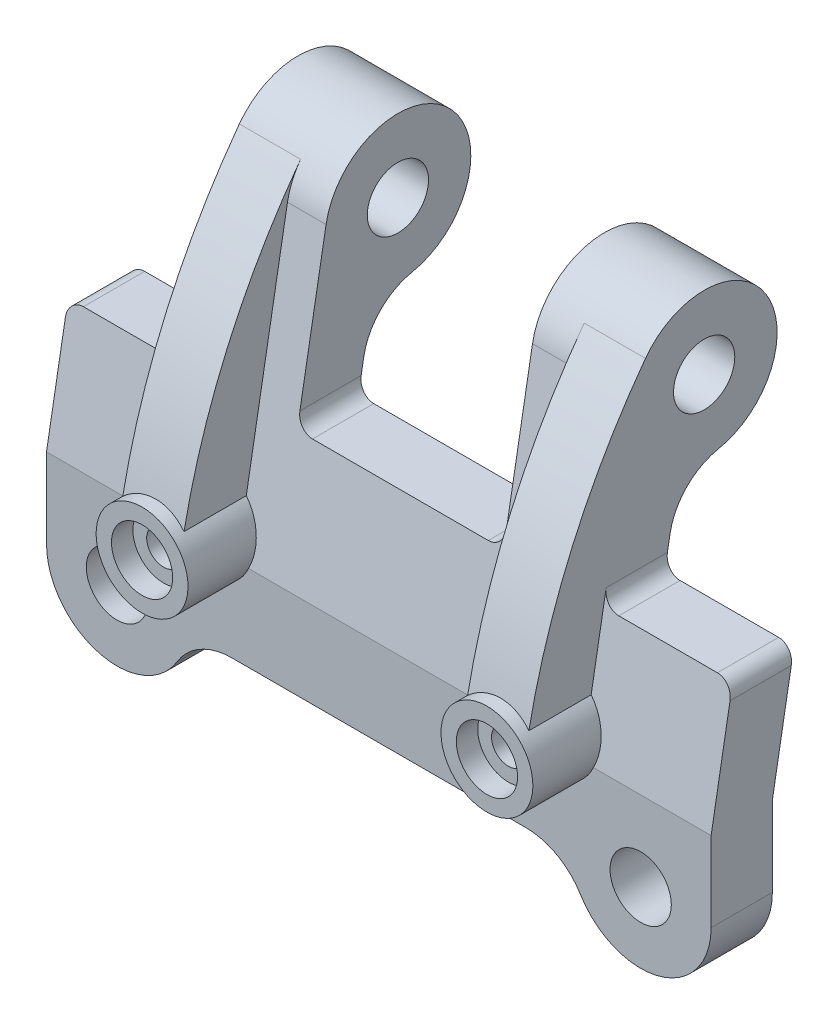
from build123d import *
from build123d.topology import SkipClean

# Parameters (mm, degrees)
BOSS_EXTRUDE1_DEPTH                                 = 13.7795
SKETCH3_R                                           = 1.27
CUT_EXTRUDE1_DEPTH                                  = 28.24278526
BOSS_EXTRUDE3_REACH                                 = 29.243
SKETCH4_R                                           = 3.024456955
BOSS_EXTRUDE3_DIRECTION_2_REACH                     = 29.243
CUT_EXTRUDE2_START                                  = -27.686
SKETCH5_R                                           = 1.27
CUT_EXTRUDE2_DEPTH                                  = 27.686
SKETCH6_W                                           = 5.3594
SKETCH6_H                                           = 6.04891391
SKETCH6_W_2                                         = 8.5598
CUT_EXTRUDE3_DEPTH                                  = 27.163772894
FILLET1_R                                           = 2.54
BOSS_EXTRUDE5_DEPTH                                 = 2.54
SKETCH8_R                                           = 1.905
BOSS_EXTRUDE6_DEPTH                                 = 5.207
CBORE_FOR_00_BINDING_HEAD_MACHINE_SCREW_D           = 1.397
CBORE_FOR_00_BINDING_HEAD_MACHINE_SCREW_DEPTH       = 3.81
CBORE_FOR_00_BINDING_HEAD_MACHINE_SCREW_CBORE_D     = 2.54
CBORE_FOR_00_BINDING_HEAD_MACHINE_SCREW_CBORE_DEPTH = 0.889
CBORE_FOR_00_BINDING_HEAD_MACHINE_SCREW_TIP         = 0.419701142
FILLET3_R                                           = 0.635


with BuildPart() as part:
    # Sketch2 → Boss-Extrude1 (new, symmetric)
    with BuildSketch(Plane(origin=(0, 0, 0), x_dir=(0, 0, -1), z_dir=(1, 0, 0))):
        Polygon((0.358296425, 8.382), (0, 6.35), (0, 0), (2.54, 0), (2.54, 6.35), (2.898296425, 8.382), (5.451158451, 22.86), (2.911158451, 22.86), align=None)
    extrude(amount=BOSS_EXTRUDE1_DEPTH, both=True)

    # Sketch3 → Cut-Extrude1 (cut, through all)
    with BuildSketch(Plane.XY):
        with Locations((-10.8585, 3.039071392)):
            Circle(SKETCH3_R)
        with Locations((10.8585, 3.039071392)):
            Circle(SKETCH3_R)
        with BuildLine():
            Line((-6.093079, 2.794), (6.093079, 2.794))
            ThreePointArc((6.093079, 2.794), (7.395567274, 2.453324554), (8.364453302, 1.518554352))
            ThreePointArc((8.364453302, 1.518554352), (11.648161508, 0.226834613), (13.7795, 3.039071392))
            Line((13.7795, 3.039071392), (14.4145, 3.039071392))
            Line((14.4145, 3.039071392), (14.4145, -0.635))
            Line((14.4145, -0.635), (-14.4145, -0.635))
            Line((-14.4145, -0.635), (-14.4145, 3.039071392))
            Line((-14.4145, 3.039071392), (-13.7795, 3.039071392))
            ThreePointArc((-13.7795, 3.039071392), (-11.648161508, 0.226834613), (-8.364453302, 1.518554352))
            ThreePointArc((-8.364453302, 1.518554352), (-7.395567274, 2.453324554), (-6.093079, 2.794))
        make_face()
        Polygon((-14.4145, 11.43), (-8.4201, 11.43), (-8.4201, 22.86), (-4.2799, 22.86), (-4.2799, 11.43), (4.2799, 11.43), (4.2799, 22.86), (8.4201, 22.86), (8.4201, 11.43), (14.4145, 11.43), (14.4145, 23.495), (-14.4145, 23.495), align=None)
    extrude(amount=-CUT_EXTRUDE1_DEPTH, mode=Mode.SUBTRACT)

    # Boss-Extrude3: up to this face of the body (flat: up to its plane)
    boss_extrude3_end = Plane(part.part.faces().sort_by_distance((13.7795, 7.234535696, -1.541147855))[0])
    # Sketch4 → Boss-Extrude3 (add, up to the picked face)
    with BuildSketch(Plane(origin=(0, 0, 0), x_dir=(0, 0, -1), z_dir=(1, 0, 0)), mode=Mode.PRIVATE) as boss_extrude3_sk1:
        with Locations(Location((5.070856, 17.6911, 0), (0, 0, 180))):
            Circle(SKETCH4_R)
    boss_extrude3_tool1 = split(extrude(boss_extrude3_sk1.sketch, amount=BOSS_EXTRUDE3_REACH, mode=Mode.PRIVATE), bisect_by=boss_extrude3_end, keep=Keep.BOTH, mode=Mode.PRIVATE)
    add(boss_extrude3_tool1.solids().sort_by(Axis((0, 17.6911, -5.070856), (1, 0, 0)))[0])

    # Boss-Extrude3 direction 2: up to this face of the body (flat: up to its plane)
    boss_extrude3_direction_2_end = Plane(part.part.faces().sort_by_distance((-13.7795, 7.234535696, -1.541147855))[0])
    # Sketch4 → Boss-Extrude3 direction 2 (add, up to the picked face)
    with BuildSketch(Plane(origin=(0, 0, 0), x_dir=(0, 0, -1), z_dir=(1, 0, 0)), mode=Mode.PRIVATE) as boss_extrude3_direction_2_sk1:
        with Locations(Location((5.070856, 17.6911, 0), (0, 0, 180))):
            Circle(SKETCH4_R)
    boss_extrude3_direction_2_tool1 = split(extrude(boss_extrude3_direction_2_sk1.sketch, amount=-BOSS_EXTRUDE3_DIRECTION_2_REACH, mode=Mode.PRIVATE), bisect_by=boss_extrude3_direction_2_end, keep=Keep.BOTH, mode=Mode.PRIVATE)
    add(boss_extrude3_direction_2_tool1.solids().sort_by(Axis((0, 17.6911, -5.070856), (-1, 0, 0)))[0])

    # Sketch5 → Cut-Extrude2 (cut)
    with SkipClean():  # the faces are left unmerged after this step: merging them gives an invalid solid
        with BuildSketch(Plane(origin=(13.7795, 0, 0), x_dir=(0, 0, -1), z_dir=(1, 0, 0)).offset(CUT_EXTRUDE2_START)):
            with Locations((5.070856, 17.6911)):
                Circle(SKETCH5_R)
            with BuildLine():
                Line((2.092347342, 18.216291439), (2.911158451, 22.86))
                Line((2.911158451, 22.86), (5.451158451, 22.86))
                Line((5.451158451, 22.86), (5.073035146, 20.71555617))
                ThreePointArc((5.073035146, 20.71555617), (3.12760733, 20.008668658), (2.092347342, 18.216291439))
            make_face()
        extrude(amount=CUT_EXTRUDE2_DEPTH, mode=Mode.SUBTRACT)

    # Sketch6 → Cut-Extrude3 (cut, through all)
    with BuildSketch(Plane.XY):
        with Locations((-11.0998, 17.6911)):
            Rectangle(SKETCH6_W, SKETCH6_H)
        with Locations((0, 17.6911)):
            Rectangle(SKETCH6_W_2, SKETCH6_H)
        with Locations((11.0998, 17.6911)):
            Rectangle(SKETCH6_W, SKETCH6_H)
    extrude(amount=-CUT_EXTRUDE3_DEPTH, mode=Mode.SUBTRACT)

    # Fillet1
    fillet1_edges = [part.edges().sort_by_distance(p)[0] for p in [
        (-6.35, 14.848295543, -4.038478794),
        (6.35, 14.848295543, -4.038478794),
    ]]
    fillet(fillet1_edges, radius=FILLET1_R)

    # Sketch7 → Boss-Extrude5 (add)
    with BuildSketch(Plane.ZY.offset(8.4201)):
        with BuildLine():
            Line((0, 6.35), (2.54, 6.35))
            ThreePointArc((2.54, 6.35), (0.810559409, 13.256647786), (-2.636800213, 19.486291439))
            ThreePointArc((-2.636800213, 19.486291439), (-2.29107391, 18.882801056), (-2.092347342, 18.216291439))
            Line((-2.092347342, 18.216291439), (0, 6.35))
        make_face()
    boss_extrude5 = extrude(amount=-BOSS_EXTRUDE5_DEPTH)

    # Mirror1: Boss-Extrude5 across plane
    add(boss_extrude5.mirror(Plane(origin=(0, 0, 0), x_dir=(0, 0, 1), z_dir=(1, 0, 0))))

    # Sketch8 → Boss-Extrude6 (add)
    with BuildSketch(Plane(origin=(0, 0, -2.54), x_dir=(-1, 0, 0), z_dir=(0, 0, -1))):
        with Locations(Location((7.1501, 7.112, 0), (0, 0, 90))):
            Circle(SKETCH8_R)
        with Locations(Location((-7.1501, 7.112, 0), (0, 0, 90))):
            Circle(SKETCH8_R)
    extrude(amount=-BOSS_EXTRUDE6_DEPTH)

    # CBORE for #00 Binding Head Machine Screw1
    with Locations(Plane.XY.offset(2.667)):
        with Locations((-7.1501, 7.112), (7.1501, 7.112)):
            CounterBoreHole(CBORE_FOR_00_BINDING_HEAD_MACHINE_SCREW_D / 2, CBORE_FOR_00_BINDING_HEAD_MACHINE_SCREW_CBORE_D / 2, CBORE_FOR_00_BINDING_HEAD_MACHINE_SCREW_CBORE_DEPTH, depth=CBORE_FOR_00_BINDING_HEAD_MACHINE_SCREW_DEPTH)
            with Locations((0, 0, -(CBORE_FOR_00_BINDING_HEAD_MACHINE_SCREW_DEPTH + CBORE_FOR_00_BINDING_HEAD_MACHINE_SCREW_TIP / 2))):  # 118° drill point
                Cone(0, CBORE_FOR_00_BINDING_HEAD_MACHINE_SCREW_D / 2, CBORE_FOR_00_BINDING_HEAD_MACHINE_SCREW_TIP, mode=Mode.SUBTRACT)

    # Fillet3
    fillet3_edges = [part.edges().sort_by_distance(p)[0] for p in [
        (-13.7795, 11.43, -2.165741062),
        (13.7795, 11.43, -2.165741062),
        (8.4201, 11.43, -2.165741062),
        (4.2799, 11.43, -2.165741062),
        (-4.2799, 11.43, -2.165741062),
        (-8.4201, 11.43, -2.165741062),
    ]]
    fillet(fillet3_edges, radius=FILLET3_R)


solid = part.part
